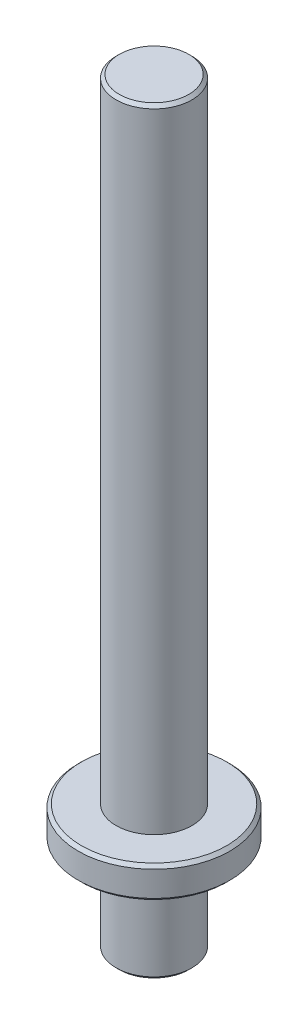
from build123d import *

# Parameters (mm, degrees)
SKETCH_1_R      = 6
EXTRUDE_1_DEPTH = 120
SKETCH_2_W      = 12
SKETCH_2_H      = 5
CHAMFER_1_SIZE  = 0.5


with BuildPart() as part:
    # 草图1 → 凸台-拉伸1 (new body)
    with BuildSketch(Plane(origin=(0, 0, 0), x_dir=(1, 0, 0), z_dir=(0, 1, 0))):
        with Locations(Location((0, 0, 0), (0, 0, 270))):
            Circle(SKETCH_1_R)
    extrude(amount=EXTRUDE_1_DEPTH)

    # 草图2 → 旋转1 (revolve)
    with BuildSketch(Plane(origin=(0, 0, 0), x_dir=(0, 0, -1), z_dir=(1, 0, 0))):
        with Locations((6, 17.5)):
            Rectangle(SKETCH_2_W, SKETCH_2_H)
    revolve(axis=Axis((0, 0, 0), (0, 1, 0)))

    # 倒角1
    chamfer_1_edges = [part.edges().sort_by_distance(p)[0] for p in [
        (0, 0, -6),
        (0, 120, -6),
        (0, 20, 12),
        (0, 15, 12),
    ]]
    chamfer(chamfer_1_edges, length=CHAMFER_1_SIZE)


solid = part.part
